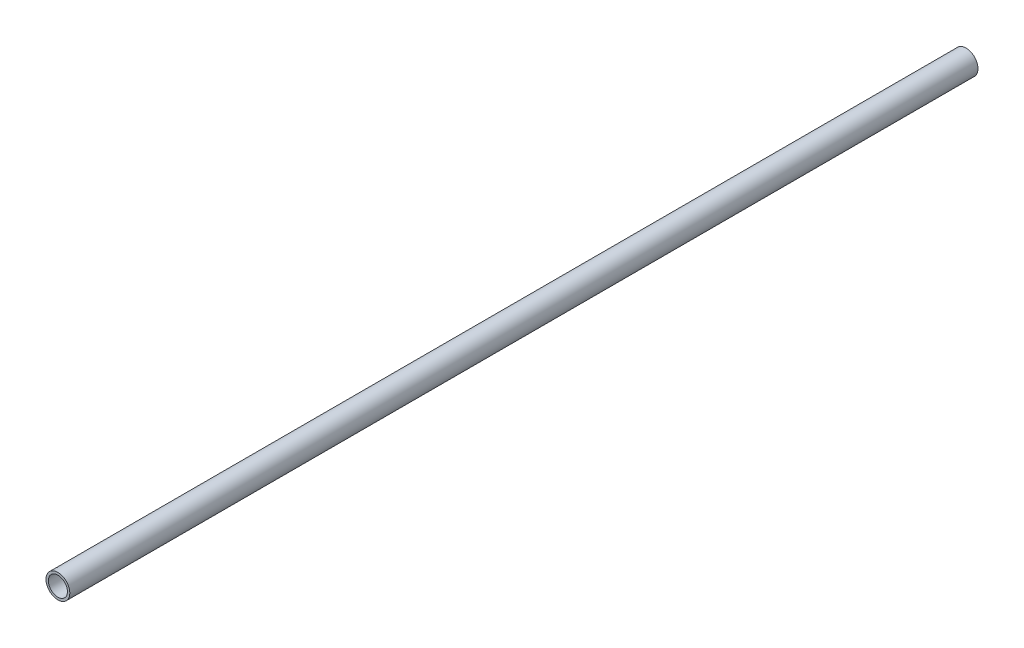
from build123d import *

# Parameters (mm, degrees)
SKETCH1_R           = 5
SKETCH1_R_2         = 4
BOSS_EXTRUDE1_DEPTH = 190.5


with BuildPart() as part:
    # Sketch1 → Boss-Extrude1 (new, symmetric)
    with BuildSketch(Plane.XY):
        Circle(SKETCH1_R)
        Circle(SKETCH1_R_2, mode=Mode.SUBTRACT)
    extrude(amount=BOSS_EXTRUDE1_DEPTH, both=True)


solid = part.part
